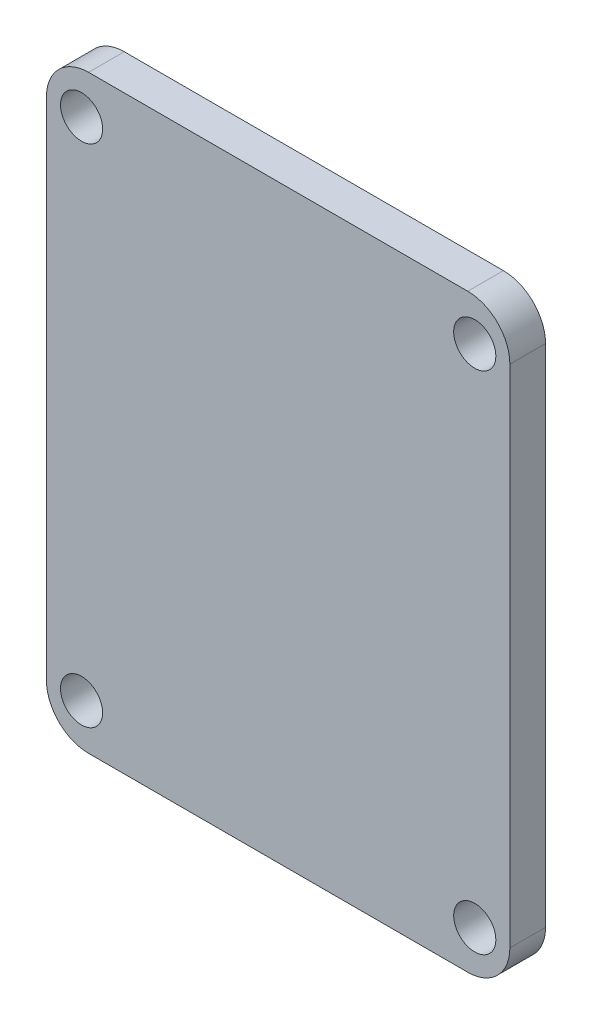
from build123d import *

# Parameters (mm, degrees)
SKETCH1_W           = 42
SKETCH1_H           = 33
SKETCH1_R           = 1.5
BOSS_EXTRUDE1_DEPTH = 2.54
FILLET1_R           = 3


with BuildPart() as part:
    # Sketch1 → Boss-Extrude1 (new body)
    with BuildSketch(Plane(origin=(0, 0, 0), x_dir=(0, 1, 0), z_dir=(0, 0, 1))):
        Rectangle(SKETCH1_W, SKETCH1_H)
        with Locations(Location((-18, 14, 0), (0, 0, 270))):
            Circle(SKETCH1_R, mode=Mode.SUBTRACT)
        with Locations(Location((-18, -14, 0), (0, 0, 270))):
            Circle(SKETCH1_R, mode=Mode.SUBTRACT)
        with Locations(Location((18, 14, 0), (0, 0, 270))):
            Circle(SKETCH1_R, mode=Mode.SUBTRACT)
        with Locations(Location((18, -14, 0), (0, 0, 270))):
            Circle(SKETCH1_R, mode=Mode.SUBTRACT)
    extrude(amount=BOSS_EXTRUDE1_DEPTH)

    # Fillet1
    fillet1_edges = [part.edges().sort_by_distance(p)[0] for p in [
        (16.5, 21, 1.27),
        (16.5, -21, 1.27),
        (-16.5, -21, 1.27),
        (-16.5, 21, 1.27),
    ]]
    fillet(fillet1_edges, radius=FILLET1_R)


solid = part.part
